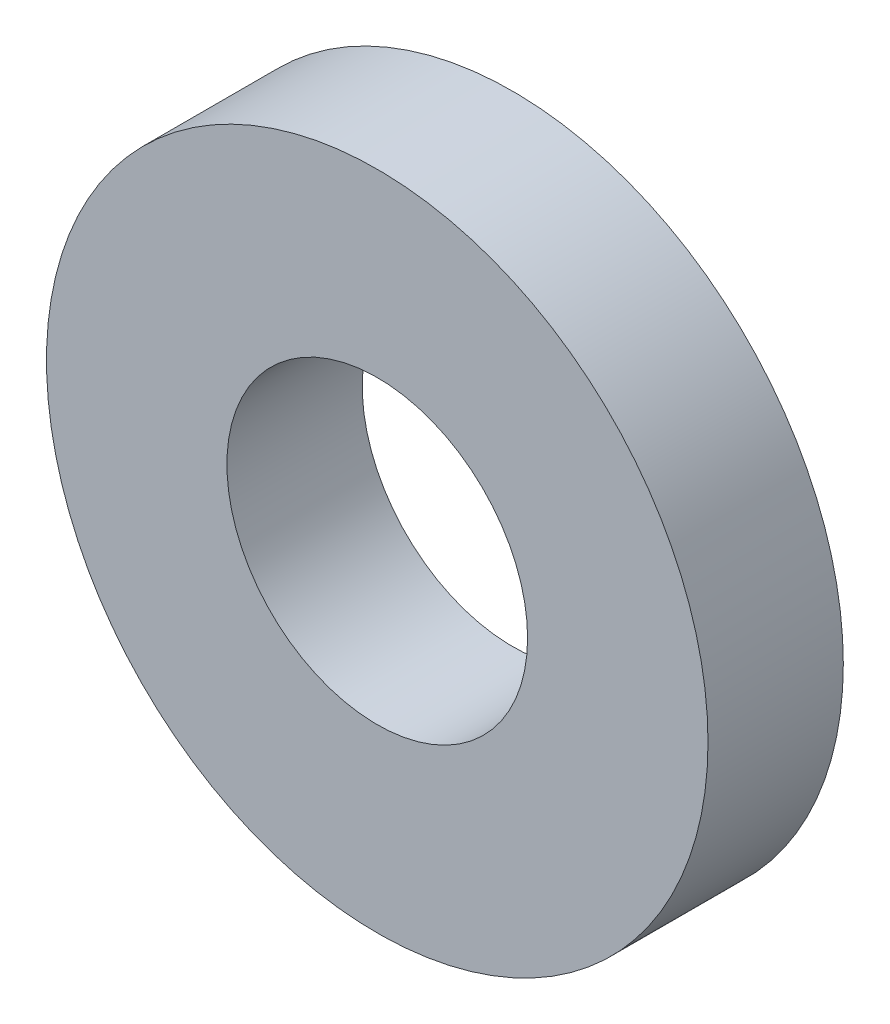
from build123d import *

# Parameters (mm, degrees)
SKETCH1_R           = 11
SKETCH1_R_2         = 5
BOSS_EXTRUDE1_DEPTH = 2.25


with BuildPart() as part:
    # Sketch1 → Boss-Extrude1 (new, symmetric)
    with BuildSketch(Plane.XY):
        Circle(SKETCH1_R)
        Circle(SKETCH1_R_2, mode=Mode.SUBTRACT)
    extrude(amount=BOSS_EXTRUDE1_DEPTH, both=True)


solid = part.part
